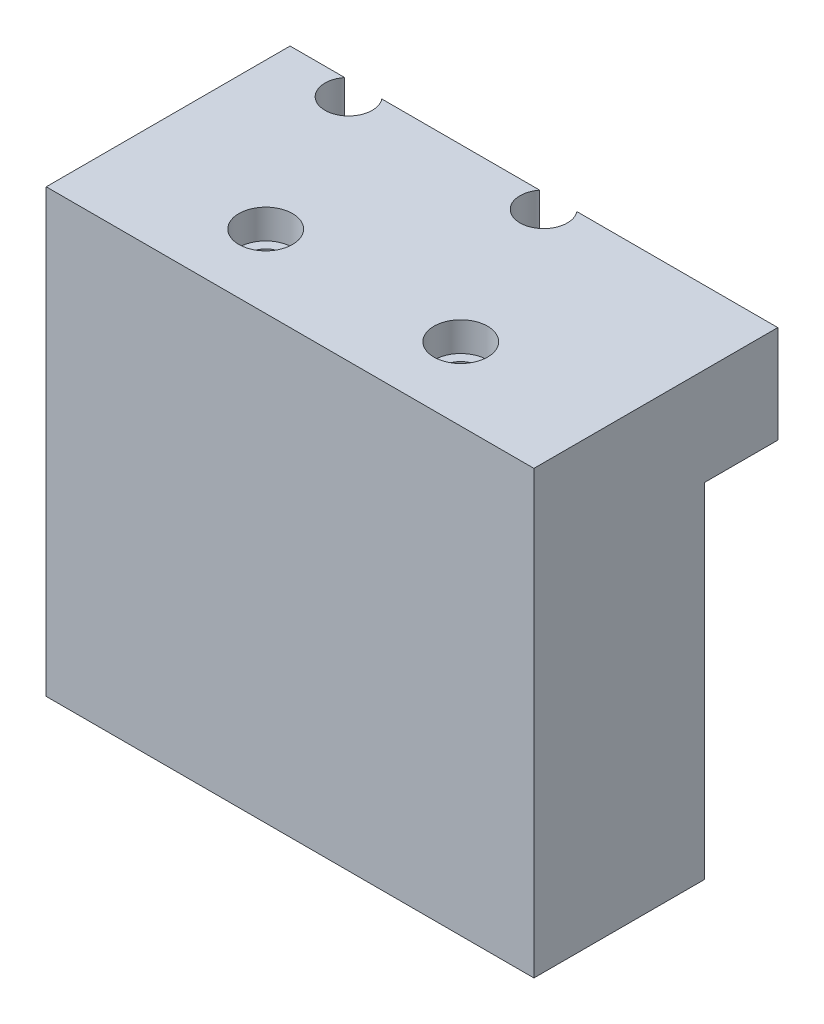
from build123d import *

# Parameters (mm, degrees)
SKETCH_1_W                   = 100
SKETCH_1_H                   = 90.5
EXTRUDE_1_DEPTH              = 50
SKETCH_2_W                   = 15
SKETCH_2_H                   = 70.5
CUT_EXTRUDE_1_DEPTH          = 144.841058116
SKETCH_4_R                   = 4.85
CUT_EXTRUDE_3_DEPTH          = 144.841058116
HOLE_WIZARD_M6_1_D           = 7
HOLE_WIZARD_M6_1_CBORE_D     = 11
HOLE_WIZARD_M6_1_CBORE_DEPTH = 6
HOLE_WIZARD_M3_1_D           = 2.5
HOLE_WIZARD_M3_1_DEPTH       = 7.5
HOLE_WIZARD_M3_1_TIP         = 0.751075774


with BuildPart() as part:
    # 草图1 → 凸台-拉伸1 (new body)
    with BuildSketch(Plane.XY):
        with Locations((50, 45.25)):
            Rectangle(SKETCH_1_W, SKETCH_1_H)
    extrude(amount=EXTRUDE_1_DEPTH)

    # 草图2 → 切除-拉伸1 (cut, through all)
    with BuildSketch(Plane.ZY):
        with Locations((7.5, 35.25)):
            Rectangle(SKETCH_2_W, SKETCH_2_H)
    extrude(amount=-CUT_EXTRUDE_1_DEPTH, mode=Mode.SUBTRACT)

    # 草图4 → 切除-拉伸3 (cut, through all)
    with BuildSketch(Plane(origin=(0, 90.5, 0), x_dir=(1, 0, 0), z_dir=(0, 1, 0))):
        with Locations((15, -3)):
            Circle(SKETCH_4_R)
        with Locations((55, -3)):
            Circle(SKETCH_4_R)
    extrude(amount=-CUT_EXTRUDE_3_DEPTH, mode=Mode.SUBTRACT)

    # M6 六角凹头螺钉的柱形沉头孔1 (through all)
    with Locations(Plane(origin=(0, 90.5, 0), x_dir=(-1, 0, 0), z_dir=(0, 1, 0))):
        with Locations((-30, 35), (-70, 35)):
            CounterBoreHole(HOLE_WIZARD_M6_1_D / 2, HOLE_WIZARD_M6_1_CBORE_D / 2, HOLE_WIZARD_M6_1_CBORE_DEPTH)

    # M3 螺纹孔1
    with Locations(Plane.ZY):
        with Locations((39, 65.5), (19.5, 65.5)):
            Hole(HOLE_WIZARD_M3_1_D / 2, depth=HOLE_WIZARD_M3_1_DEPTH)
            with Locations((0, 0, -(HOLE_WIZARD_M3_1_DEPTH + HOLE_WIZARD_M3_1_TIP / 2))):  # 118° drill point
                Cone(0, HOLE_WIZARD_M3_1_D / 2, HOLE_WIZARD_M3_1_TIP, mode=Mode.SUBTRACT)


solid = part.part
